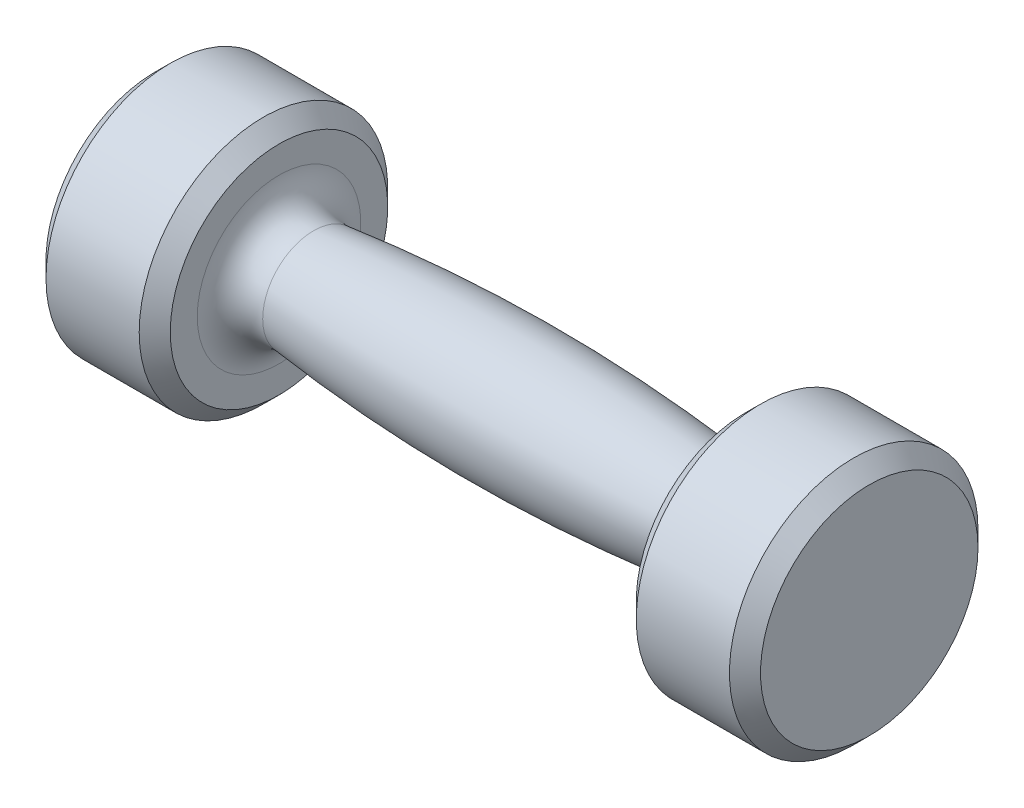
from build123d import *

# Parameters (mm, degrees)
SKETCH1_R           = 15
BOSS_EXTRUDE1_DEPTH = 115
SKETCH2_R           = 40
BOSS_EXTRUDE2_DEPTH = 40
BOSS_EXTRUDE3_START = -40
SKETCH3_R           = 40
BOSS_EXTRUDE3_DEPTH = 40
CHAMFER1_SIZE       = 5
FILLET1_R           = 10


with BuildPart() as part:
    # Sketch1 → Boss-Extrude1 (new, symmetric)
    with BuildSketch(Plane(origin=(0, 0, 0), x_dir=(0, 0, -1), z_dir=(1, 0, 0))):
        Circle(SKETCH1_R)
    extrude(amount=BOSS_EXTRUDE1_DEPTH, both=True)

    # Sketch2 → Boss-Extrude2 (add)
    with BuildSketch(Plane(origin=(115, 0, 0), x_dir=(0, 0, -1), z_dir=(1, 0, 0))):
        Circle(SKETCH2_R)
    extrude(amount=-BOSS_EXTRUDE2_DEPTH)

    # Sketch3 → Boss-Extrude3 (add)
    with BuildSketch(Plane.ZY.offset(115).offset(BOSS_EXTRUDE3_START)):
        with Locations(Location((0, 0, 0), (0, 0, 180))):
            Circle(SKETCH3_R)
    extrude(amount=BOSS_EXTRUDE3_DEPTH)

    # Sketch5 → Revolve1 (revolve)
    with BuildSketch(Plane.XY, mode=Mode.PRIVATE) as revolve1_sk:
        with BuildLine():
            Line((-75, 15), (75, 15))
            ThreePointArc((75, 15), (0, 20), (-75, 15))
        make_face()
    revolve(revolve1_sk.sketch.rotate(Axis((-125.396729405, 0, 0), (1, 0, 0)), 90), axis=Axis((-125.396729405, 0, 0), (1, 0, 0)))

    # Chamfer1
    chamfer1_edges = [part.edges().sort_by_distance(p)[0] for p in [
        (-75, 0, 40),
        (-115, 0, 40),
        (75, 0, 40),
        (115, 0, 40),
    ]]
    chamfer(chamfer1_edges, length=CHAMFER1_SIZE)

    # Fillet1
    fillet1_edges = [part.edges().sort_by_distance(p)[0] for p in [
        (75, 0, -15),
        (-75, 0, -15),
    ]]
    fillet(fillet1_edges, radius=FILLET1_R)


solid = part.part
